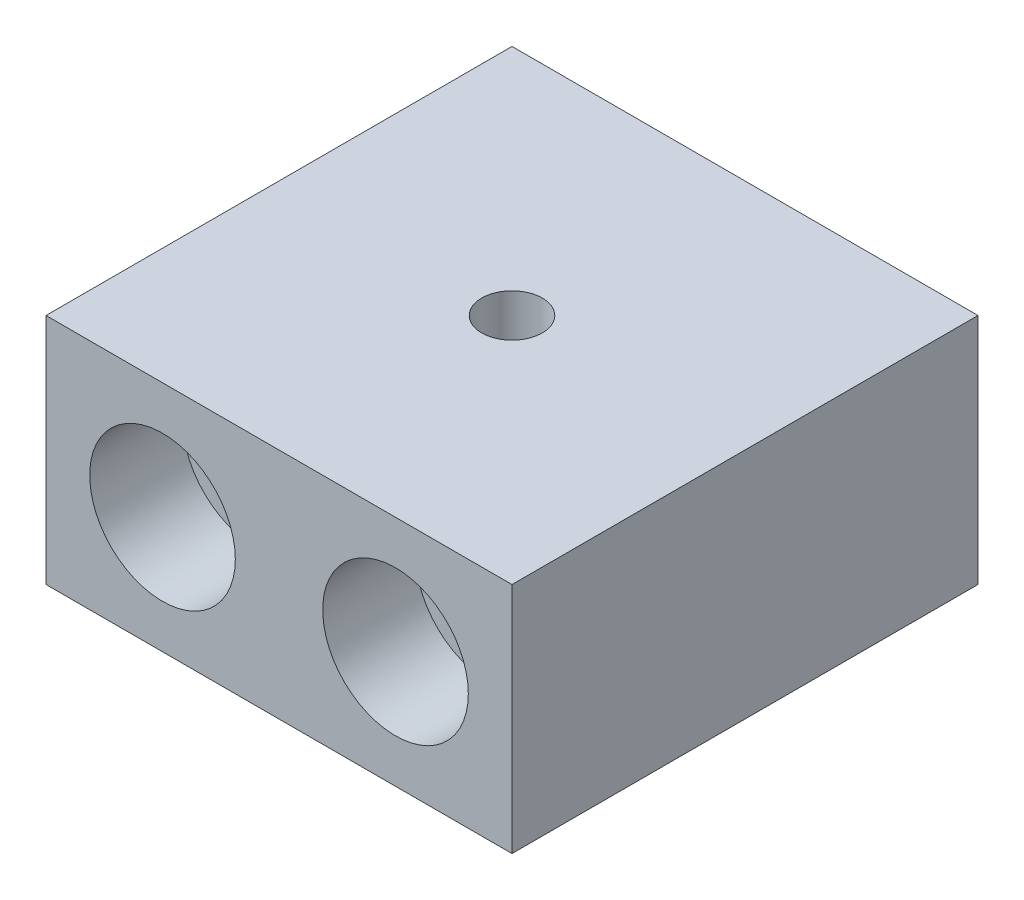
from build123d import *

# Parameters (mm, degrees)
SKETCH1_W                                      = 25.4
SKETCH1_H                                      = 12.7
BOSS_EXTRUDE1_DEPTH                            = 12.7
CBORE_FOR_8_SOCKET_HEAD_CAP_SCREW1_D           = 4.9149
CBORE_FOR_8_SOCKET_HEAD_CAP_SCREW1_CBORE_D     = 7.9375
CBORE_FOR_8_SOCKET_HEAD_CAP_SCREW1_CBORE_DEPTH = 5.08
M4X0_7_TAPPED_HOLE1_D                          = 3.3
M4X0_7_TAPPED_HOLE1_DEPTH                      = 11.6332
M4X0_7_TAPPED_HOLE1_TIP                        = 0.991420021


with BuildPart() as part:
    # Sketch1 → Boss-Extrude1 (new, symmetric)
    with BuildSketch(Plane.XY):
        Rectangle(SKETCH1_W, SKETCH1_H)
    extrude(amount=BOSS_EXTRUDE1_DEPTH, both=True)

    # CBORE for #8 Socket Head Cap Screw1 (through all)
    with Locations(Plane.XY.offset(12.7)):
        with Locations((-6.35, 0), (6.35, 0)):
            CounterBoreHole(CBORE_FOR_8_SOCKET_HEAD_CAP_SCREW1_D / 2, CBORE_FOR_8_SOCKET_HEAD_CAP_SCREW1_CBORE_D / 2, CBORE_FOR_8_SOCKET_HEAD_CAP_SCREW1_CBORE_DEPTH)

    # M4x0.7 Tapped Hole1
    with Locations(Plane(origin=(0, 6.35, 0), x_dir=(1, 0, 0), z_dir=(0, 1, 0))):
        with Locations((0, 0)):
            Hole(M4X0_7_TAPPED_HOLE1_D / 2, depth=M4X0_7_TAPPED_HOLE1_DEPTH)
            with Locations((0, 0, -(M4X0_7_TAPPED_HOLE1_DEPTH + M4X0_7_TAPPED_HOLE1_TIP / 2))):  # 118° drill point
                Cone(0, M4X0_7_TAPPED_HOLE1_D / 2, M4X0_7_TAPPED_HOLE1_TIP, mode=Mode.SUBTRACT)


solid = part.part
